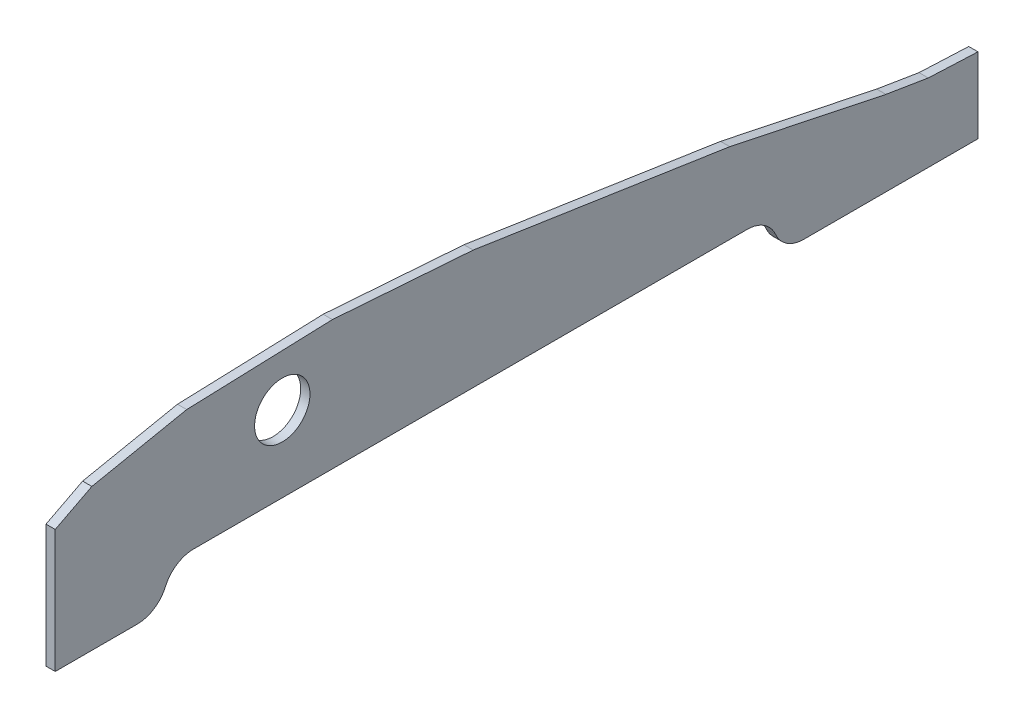
from build123d import *

# Parameters (mm, degrees)
BOSS_EXTRUDE1_DEPTH = 3
CUT_EXTRUDE1_DEPTH  = 3
FILLET1_R           = 10
SKETCH3_R           = 9
CUT_EXTRUDE2_DEPTH  = 3


with BuildPart() as part:
    # Sketch1 → Boss-Extrude1 (new body)
    with BuildSketch(Plane(origin=(0, 0, 0), x_dir=(0, 0, -1), z_dir=(1, 0, 0))):
        Polygon((0, 0), (11.910798094, 6.158004928), (42.739414765, 12.383521095), (90.106781804, 14.033136775), (135.887385092, 10.713704644), (219.287488067, -1.876713431), (270.057015241, -12.532639482), (283.823146281, -14.792882614), (299.988096251, -15.517362165), (299.988096251, -40), (0, -40), align=None)
    extrude(amount=BOSS_EXTRUDE1_DEPTH)

    # Sketch2 → Cut-Extrude1 (cut)
    with BuildSketch(Plane(origin=(3, 0, 0), x_dir=(0, 0, -1), z_dir=(1, 0, 0))):
        with BuildLine():
            Line((35, -40), (35, -38))
            ThreePointArc((35, -38), (37.928932188, -30.928932188), (45, -28))
            Line((45, -28), (225, -28))
            ThreePointArc((225, -28), (232.071067812, -30.928932188), (235, -38))
            Line((235, -38), (235, -40))
            Line((235, -40), (35, -40))
        make_face()
    extrude(amount=-CUT_EXTRUDE1_DEPTH, mode=Mode.SUBTRACT)

    # Fillet1
    fillet1_edges = [part.edges().sort_by_distance(p)[0] for p in [
        (1.5, -40, -235),
        (1.5, -40, -35),
    ]]
    fillet(fillet1_edges, radius=FILLET1_R)

    # Sketch3 → Cut-Extrude2 (cut)
    with BuildSketch(Plane(origin=(3, 0, 0), x_dir=(0, 0, -1), z_dir=(1, 0, 0))):
        with Locations((73.81, -3.27)):
            Circle(SKETCH3_R)
    extrude(amount=-CUT_EXTRUDE2_DEPTH, mode=Mode.SUBTRACT)


solid = part.part
